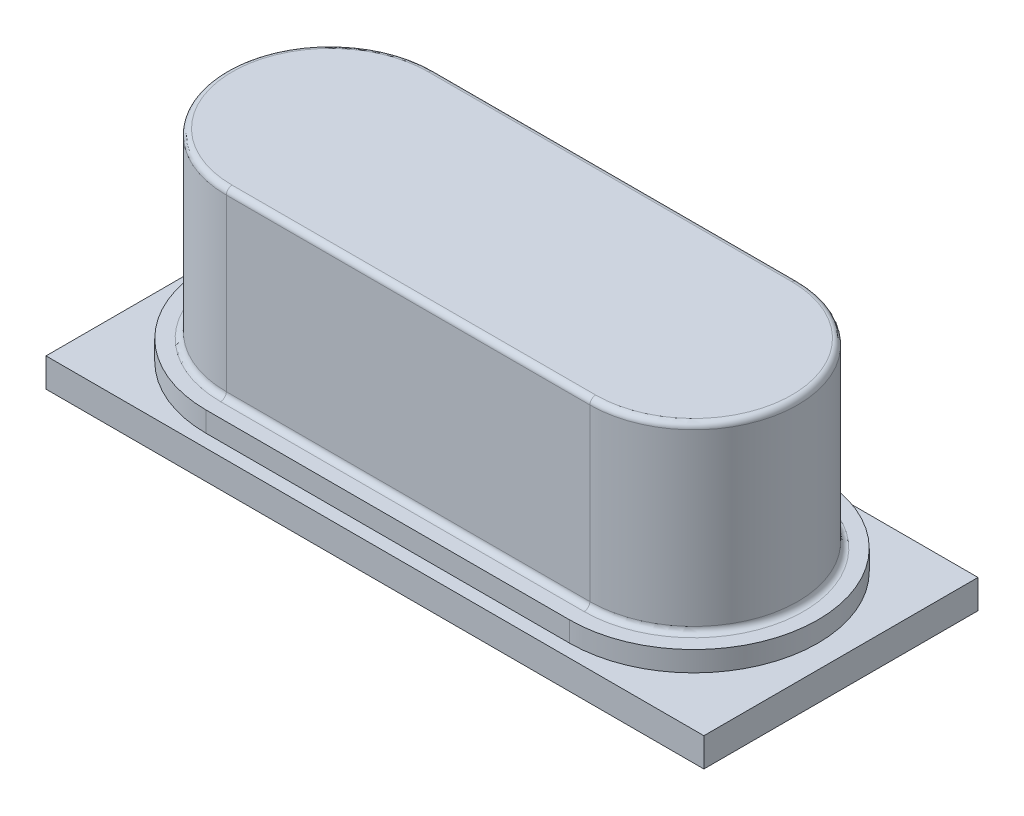
from build123d import *

# Parameters (mm, degrees)
SKETCH1_W           = 11.4
SKETCH1_H           = 4.75
BOSS_EXTRUDE1_DEPTH = 0.5
BOSS_EXTRUDE2_DEPTH = 3.5
BOSS_EXTRUDE3_DEPTH = 0.35
FILLET1_R           = 0.1


with BuildPart() as part:
    # Sketch1 → Boss-Extrude1 (new body)
    with BuildSketch(Plane(origin=(0, 0, 0), x_dir=(1, 0, 0), z_dir=(0, 1, 0))):
        Rectangle(SKETCH1_W, SKETCH1_H)
    extrude(amount=BOSS_EXTRUDE1_DEPTH)

    # Sketch2 → Boss-Extrude2 (add)
    with BuildSketch(Plane(origin=(0, 0.5, 0), x_dir=(1, 0, 0), z_dir=(0, 1, 0))):
        with BuildLine():
            Line((3.15, 1.8), (-3.15, 1.8))
            ThreePointArc((-3.15, 1.8), (-4.95, 0), (-3.15, -1.8))
            Line((-3.15, -1.8), (3.15, -1.8))
            ThreePointArc((3.15, -1.8), (4.95, 0), (3.15, 1.8))
        make_face()
    extrude(amount=BOSS_EXTRUDE2_DEPTH)

    # Sketch2<3> → Boss-Extrude3 (add)
    with BuildSketch(Plane(origin=(0, 0.5, 0), x_dir=(1, 0, 0), z_dir=(0, 1, 0))):
        with BuildLine():
            Line((-3.15, 2.15), (3.15, 2.15))
            ThreePointArc((3.15, 2.15), (5.3, 0), (3.15, -2.15))
            Line((3.15, -2.15), (-3.15, -2.15))
            ThreePointArc((-3.15, -2.15), (-5.3, 0), (-3.15, 2.15))
        make_face()
        with BuildLine():
            Line((-3.15, 1.8), (3.15, 1.8))
            ThreePointArc((3.15, 1.8), (4.95, 0), (3.15, -1.8))
            Line((3.15, -1.8), (-3.15, -1.8))
            ThreePointArc((-3.15, -1.8), (-4.95, 0), (-3.15, 1.8))
        make_face(mode=Mode.SUBTRACT)
    extrude(amount=BOSS_EXTRUDE3_DEPTH)

    # Fillet1
    fillet1_edges = [part.edges().sort_by_distance(p)[0] for p in [
        (-4.95, 0.85, 0),
        (0, 0.85, -1.8),
        (4.95, 0.85, 0),
        (-4.95, 4, 0),
        (0, 4, -1.8),
        (4.95, 4, 0),
        (0, 4, 1.8),
        (0, 0.85, 1.8),
    ]]
    fillet(fillet1_edges, radius=FILLET1_R)


solid = part.part
